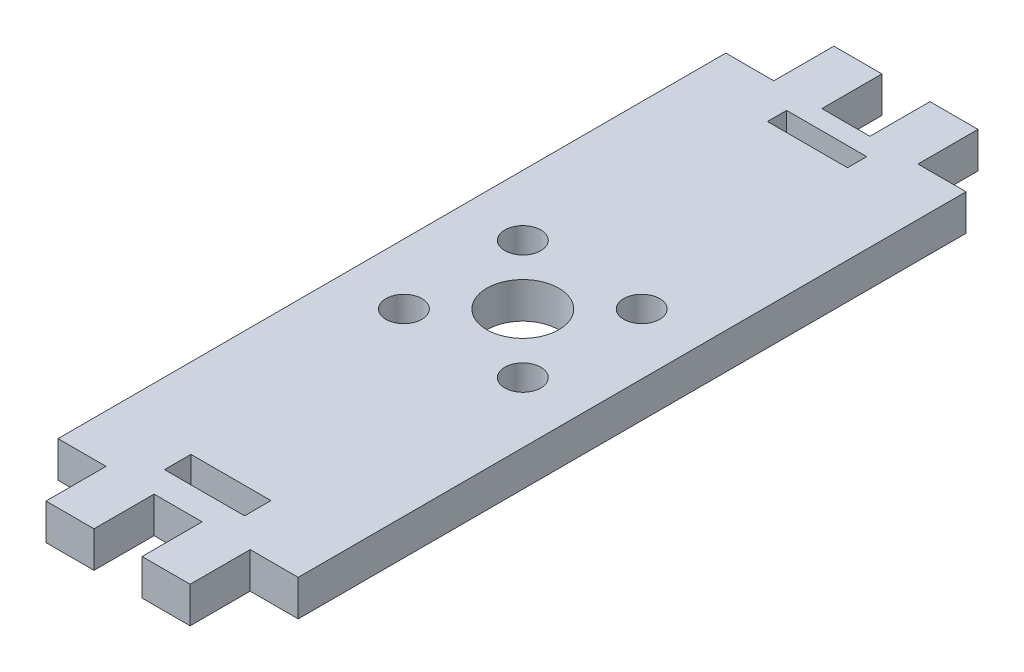
from build123d import *

# Parameters (mm, degrees)
SKETCH_1_W          = 20
SKETCH_1_H          = 55.6
EXTRUDE_1_DEPTH     = 3
SKETCH_2_W          = 4
SKETCH_2_H          = 5
EXTRUDE_2_DEPTH     = 3
SKETCH_3_W          = 6.666666666
SKETCH_3_H          = 2.2
SKETCH_3_R          = 1.5
SKETCH_3_R_2        = 3
SKETCH_3_H_2        = 1.6
CUT_EXTRUDE_1_DEPTH = 10


with BuildPart() as part:
    # 草图1 → 凸台-拉伸1 (new body)
    with BuildSketch(Plane(origin=(0, 0, 0), x_dir=(1, 0, 0), z_dir=(0, 1, 0))):
        with Locations((-10, -27.8)):
            Rectangle(SKETCH_1_W, SKETCH_1_H)
    extrude(amount=EXTRUDE_1_DEPTH)

    # 草图2 → 凸台-拉伸2 (add)
    with BuildSketch(Plane(origin=(0, 3, 0), x_dir=(1, 0, 0), z_dir=(0, 1, 0))):
        with Locations((-14, 2.5)):
            Rectangle(SKETCH_2_W, SKETCH_2_H)
        with Locations((-6, 2.5)):
            Rectangle(SKETCH_2_W, SKETCH_2_H)
        with Locations((-14, -58.1)):
            Rectangle(SKETCH_2_W, SKETCH_2_H)
        with Locations((-6, -58.1)):
            Rectangle(SKETCH_2_W, SKETCH_2_H)
    extrude(amount=-EXTRUDE_2_DEPTH)

    # 草图3 → 切除-拉伸1 (cut)
    with BuildSketch(Plane(origin=(0, 3, 0), x_dir=(1, 0, 0), z_dir=(0, 1, 0))):
        with Locations((-10, -52.3)):
            Rectangle(SKETCH_3_W, SKETCH_3_H)
        with Locations(Location((-5.050252532, -31.849747468, 0), (0, 0, 270))):
            Circle(SKETCH_3_R)
        with Locations(Location((-10, -26.9, 0), (0, 0, 270))):
            Circle(SKETCH_3_R_2)
        with Locations((-10, -2.4)):
            Rectangle(SKETCH_3_W, SKETCH_3_H_2)
        with Locations(Location((-14.949747468, -31.849747468, 0), (0, 0, 270))):
            Circle(SKETCH_3_R)
        with Locations(Location((-14.949747468, -21.950252532, 0), (0, 0, 270))):
            Circle(SKETCH_3_R)
        with Locations(Location((-5.050252532, -21.950252532, 0), (0, 0, 270))):
            Circle(SKETCH_3_R)
    extrude(amount=-CUT_EXTRUDE_1_DEPTH, mode=Mode.SUBTRACT)


solid = part.part
